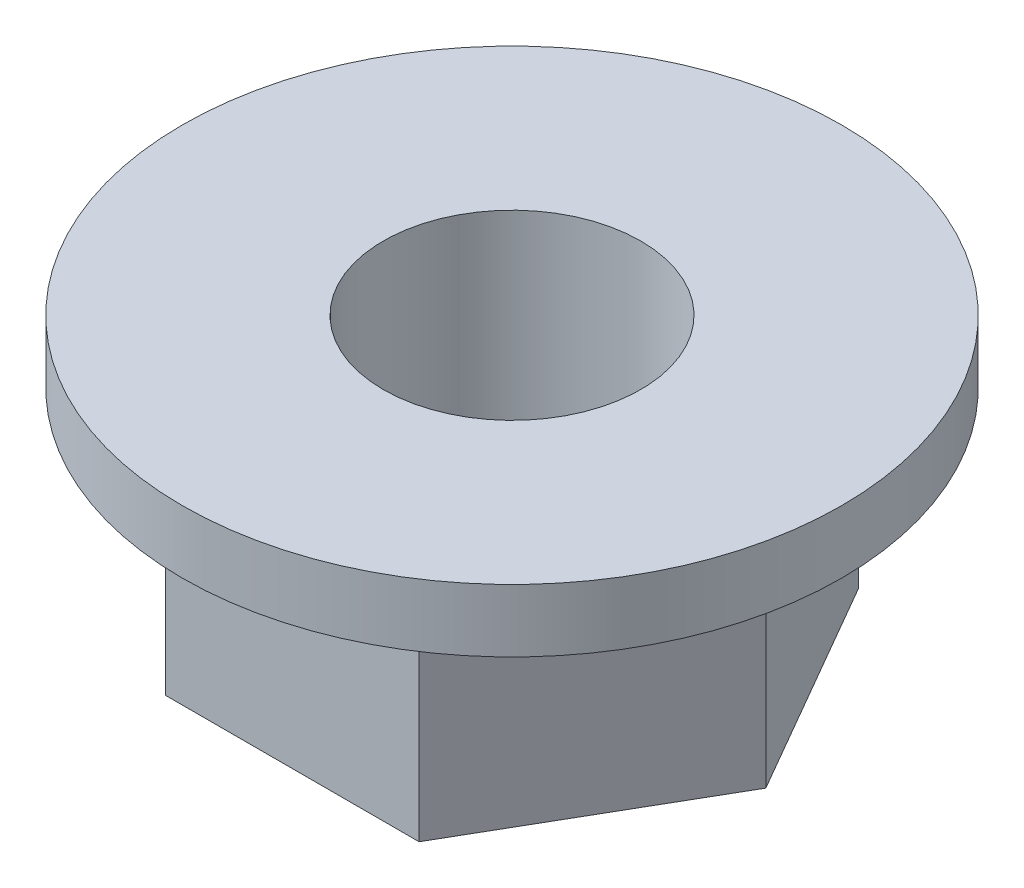
from build123d import *

# Parameters (mm, degrees)
HEX_NUT_DEPTH                     = 3.5
NUT_FLANGE_SKETCH_R               = 5.25
NUT_FLANGE_DEPTH                  = 1
M4_INTERNAL_THREAD_BLANK_SKETCH_R = 2.05
M4_INTERNAL_THREAD_BLANK_DEPTH    = 4.7


with BuildPart() as part:
    # Hex Nut Sketch → Hex Nut (new body)
    with BuildSketch(Plane(origin=(0, -138.5, 0), x_dir=(1, 0, 0), z_dir=(0, 1, 0))):
        Polygon((-16.250199362, 0), (-18.270925304, -3.5), (-22.312377188, -3.5), (-24.33310313, 0), (-22.312377188, 3.5), (-18.270925304, 3.5), align=None)
    extrude(amount=HEX_NUT_DEPTH)

    # Nut Flange Sketch → Nut Flange (add)
    with BuildSketch(Plane(origin=(0, -135, 0), x_dir=(1, 0, 0), z_dir=(0, 1, 0))):
        with Locations(Location((-20.291651246, 0, 0), (0, 0, 270))):
            Circle(NUT_FLANGE_SKETCH_R)
    extrude(amount=NUT_FLANGE_DEPTH)

    # M4 Internal Thread Blank Sketch → M4 Internal Thread Blank (cut)
    with BuildSketch(Plane(origin=(0, -138.6, 0), x_dir=(1, 0, 0), z_dir=(0, 1, 0))):
        with Locations(Location((-20.291651246, 0, 0), (0, 0, 90))):
            Circle(M4_INTERNAL_THREAD_BLANK_SKETCH_R)
    extrude(amount=M4_INTERNAL_THREAD_BLANK_DEPTH, mode=Mode.SUBTRACT)


solid = part.part
